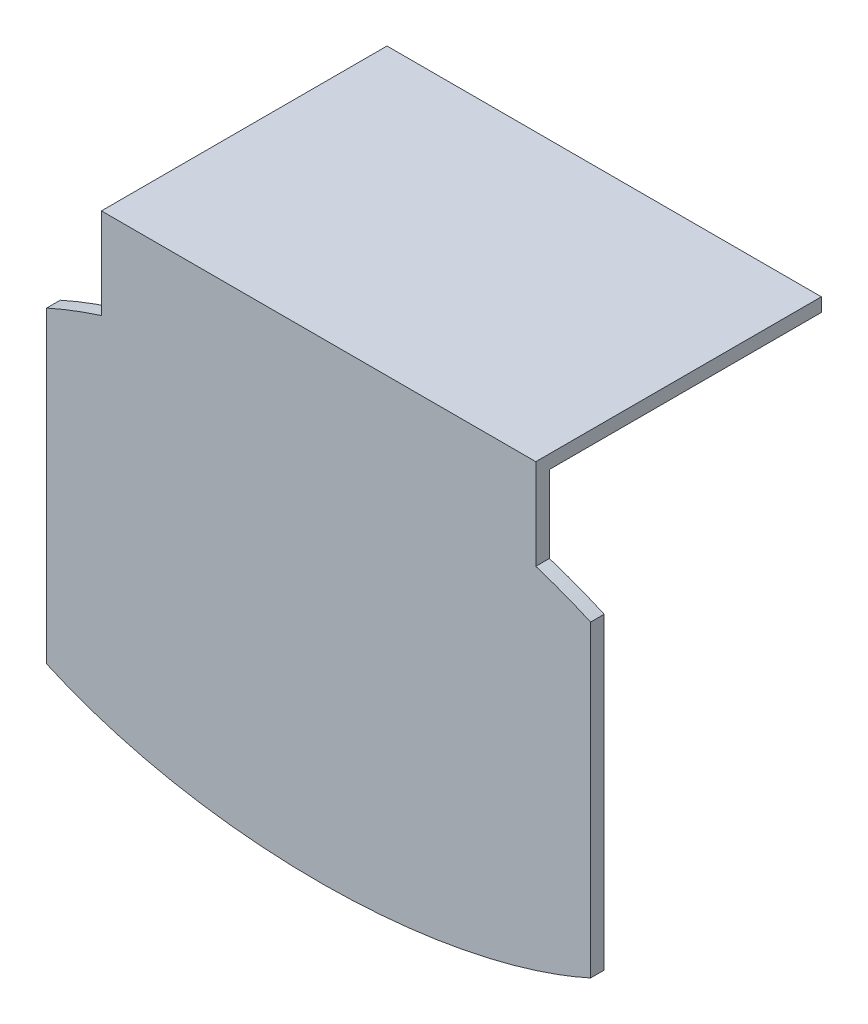
from build123d import *

# Parameters (mm, degrees)
EXTRUDE_1_DEPTH           = 3
CUT_EXTRUDE_10_DEPTH      = 76.423640864
CUT_EXTRUDE_10_DEPTH_BACK = 3
SKETCH_9_W                = 95.828885904
SKETCH_9_H                = 3
EXTRUDE_2_DEPTH           = 20
SKETCH_10_W               = 95.828885904
SKETCH_10_H               = 3
EXTRUDE_3_DEPTH           = 60


with BuildPart() as part:
    # 草图1 → 凸台-拉伸1 (new body)
    with BuildSketch(Plane.XY):
        with BuildLine():
            Line((-60, 34), (-60, -34))
            add(Edge.make_bspline(
                [(-60, -34), (0, -61.168399395), (60, -34)],
                knots=[0.841357477, 0.841357477, 0.841357477, 2.300235176, 2.300235176, 2.300235176], degree=2, weights=[1, 0.745548499, 1]))
            Line((60, -34), (60, 34))
            add(Edge.make_bspline(
                [(60, 34), (0, 61.168399395), (-60, 34)],
                knots=[3.982950131, 3.982950131, 3.982950131, 5.44182783, 5.44182783, 5.44182783], degree=2, weights=[1, 0.745548499, 1]))
        make_face()
    extrude(amount=EXTRUDE_1_DEPTH)

    # 草图7 → 切除-拉伸10 (cut, two sides: drawn at the far end of the back side and taken through both)
    with BuildSketch(Plane(origin=(0, 0, 0), x_dir=(-1, 0, 0), z_dir=(0, 0, -1)).offset(-CUT_EXTRUDE_10_DEPTH_BACK)):
        with BuildLine():
            Line((-47.914442952, 38.608895735), (-0.047490379, 38.608895735))
            Line((-0.047490379, 38.608895735), (47.914442952, 38.608895735))
            add(Edge.make_bspline(
                [(-47.914442952, 38.608895735), (0, 53.86648698), (47.914442952, 38.608895735)],
                knots=[4.161758339, 4.161758339, 4.161758339, 5.263019622, 5.263019622, 5.263019622], degree=2, weights=[0.945270908, 0.800277591, 0.945270908]))
        make_face()
    extrude(amount=CUT_EXTRUDE_10_DEPTH + CUT_EXTRUDE_10_DEPTH_BACK, mode=Mode.SUBTRACT)

    # 草图9 → 凸台-拉伸2 (add)
    with BuildSketch(Plane(origin=(0, 38.608895735, 0), x_dir=(1, 0, 0), z_dir=(0, 1, 0))):
        with Locations((0, -1.5)):
            Rectangle(SKETCH_9_W, SKETCH_9_H)
    extrude(amount=EXTRUDE_2_DEPTH)

    # 草图10 → 凸台-拉伸3 (add)
    with BuildSketch(Plane(origin=(0, 0, 0), x_dir=(-1, 0, 0), z_dir=(0, 0, -1))):
        with Locations((0, 57.108895735)):
            Rectangle(SKETCH_10_W, SKETCH_10_H)
    extrude(amount=EXTRUDE_3_DEPTH)


solid = part.part
